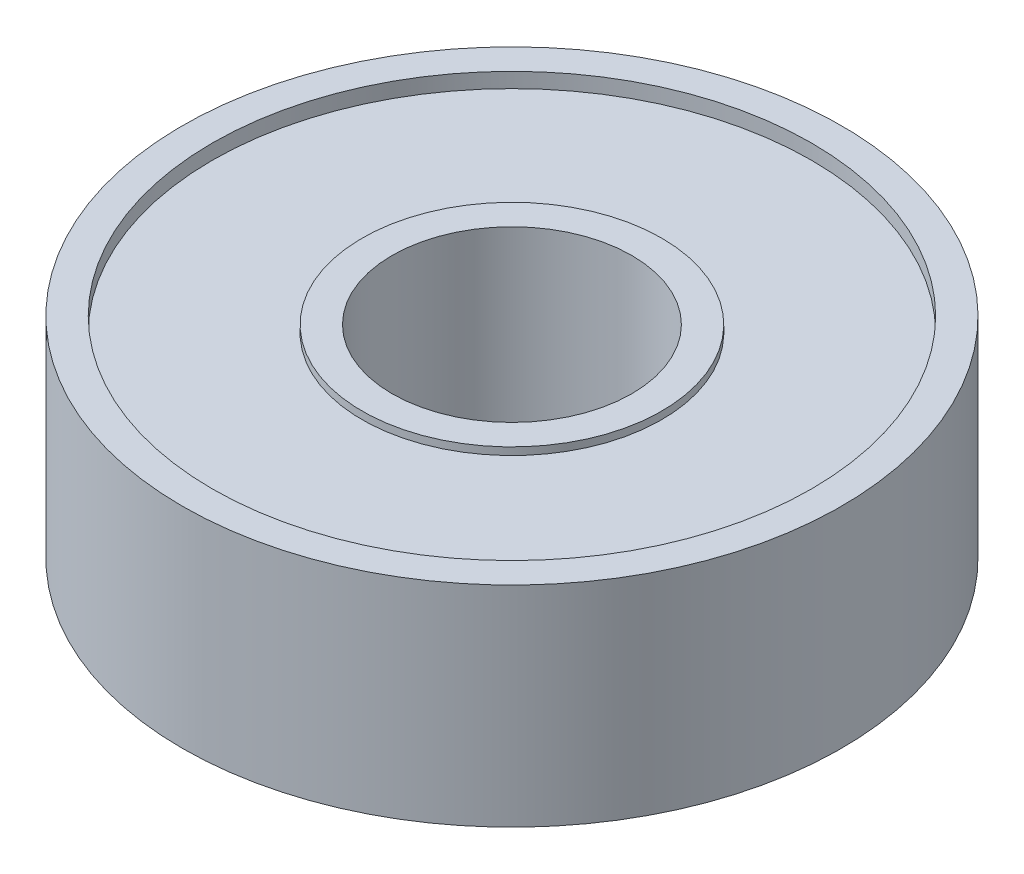
from build123d import *

# Parameters (mm, degrees)
SKETCH1_R           = 11
BOSS_EXTRUDE1_DEPTH = 3
SKETCH2_R           = 11
SKETCH2_R_2         = 10
BOSS_EXTRUDE2_DEPTH = 3.5
SKETCH4_R           = 5
BOSS_EXTRUDE3_DEPTH = 3.25
SKETCH5_R           = 4
CUT_EXTRUDE1_DEPTH  = 10


with BuildPart() as part:
    # Sketch1 → Boss-Extrude1 (new, symmetric)
    with BuildSketch(Plane(origin=(0, 0, 0), x_dir=(1, 0, 0), z_dir=(0, 1, 0))):
        with Locations(Location((0, 0, 0), (0, 0, 270))):
            Circle(SKETCH1_R)
    extrude(amount=BOSS_EXTRUDE1_DEPTH, both=True)

    # Sketch2 → Boss-Extrude2 (add, symmetric)
    with BuildSketch(Plane(origin=(0, 0, 0), x_dir=(1, 0, 0), z_dir=(0, 1, 0))):
        with Locations(Location((0, 0, 0), (0, 0, 270))):
            Circle(SKETCH2_R)
        with Locations(Location((0, 0, 0), (0, 0, 270))):
            Circle(SKETCH2_R_2, mode=Mode.SUBTRACT)
    extrude(amount=BOSS_EXTRUDE2_DEPTH, both=True)

    # Sketch4 → Boss-Extrude3 (add, symmetric)
    with BuildSketch(Plane(origin=(0, 0, 0), x_dir=(1, 0, 0), z_dir=(0, 1, 0))):
        with Locations(Location((0, 0, 0), (0, 0, 90))):
            Circle(SKETCH4_R)
    extrude(amount=BOSS_EXTRUDE3_DEPTH, both=True)

    # Sketch5 → Cut-Extrude1 (cut)
    with BuildSketch(Plane(origin=(0, 3.25, 0), x_dir=(1, 0, 0), z_dir=(0, 1, 0))):
        with Locations(Location((0, 0, 0), (0, 0, 270))):
            Circle(SKETCH5_R)
    extrude(amount=-CUT_EXTRUDE1_DEPTH, mode=Mode.SUBTRACT)


solid = part.part
